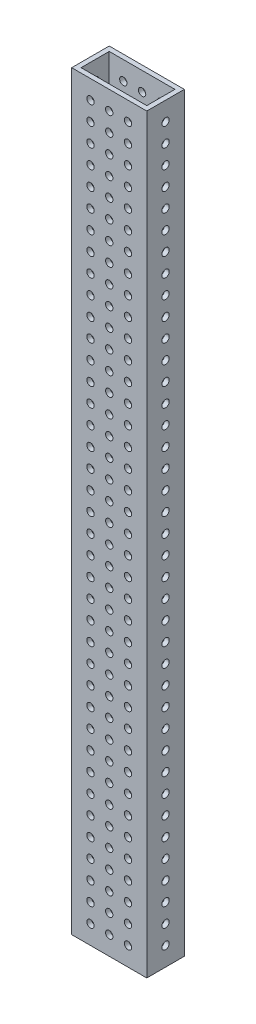
from build123d import *

# Parameters (mm, degrees)
SKETCH1_W            = 50.8
SKETCH1_H            = 25.4
SKETCH1_W_2          = 44.45
SKETCH1_H_2          = 19.05
BOSS_EXTRUDE1_DEPTH  = 254
SKETCH2_R            = 2.4892
CUT_EXTRUDE1_DEPTH   = 261.272549455
LPATTERN1_COUNT      = 39
LPATTERN1_PITCH      = 12.7
LPATTERN1_COUNT_DIR2 = 3
LPATTERN1_PITCH_DIR2 = 12.7
SKETCH3_R            = 2.4892
CUT_EXTRUDE2_DEPTH   = 261.272549455
LPATTERN2_COUNT      = 39
LPATTERN2_PITCH      = 12.7


with BuildPart() as part:
    # Sketch1 → Boss-Extrude1 (new, symmetric)
    with BuildSketch(Plane(origin=(0, 0, 0), x_dir=(1, 0, 0), z_dir=(0, 1, 0))):
        with Locations((25.4, 12.7)):
            Rectangle(SKETCH1_W, SKETCH1_H)
        with Locations((25.4, 12.7)):
            Rectangle(SKETCH1_W_2, SKETCH1_H_2, mode=Mode.SUBTRACT)
    extrude(amount=BOSS_EXTRUDE1_DEPTH, both=True)

    # Sketch2 → Cut-Extrude1 (cut, through all)
    with BuildSketch(Plane.XY):
        with Locations((12.7, 241.3)):
            Circle(SKETCH2_R)
    cut_extrude1 = extrude(amount=-CUT_EXTRUDE1_DEPTH, mode=Mode.SUBTRACT)

    # LPattern1: Cut-Extrude1 39 × 3
    with Locations(*[(j * LPATTERN1_PITCH_DIR2, -i * LPATTERN1_PITCH, 0) for i in range(LPATTERN1_COUNT) for j in range(LPATTERN1_COUNT_DIR2) if (i, j) != (0, 0)]):
        add(cut_extrude1, mode=Mode.SUBTRACT)

    # Sketch3 → Cut-Extrude2 (cut, through all)
    with BuildSketch(Plane(origin=(50.8, 0, 0), x_dir=(0, 0, -1), z_dir=(1, 0, 0))):
        with Locations((12.7, 241.3)):
            Circle(SKETCH3_R)
    cut_extrude2 = extrude(amount=-CUT_EXTRUDE2_DEPTH, mode=Mode.SUBTRACT)

    # LPattern2: Cut-Extrude2 ×39
    with Locations(*[(0, -i * LPATTERN2_PITCH, 0) for i in range(1, LPATTERN2_COUNT)]):
        add(cut_extrude2, mode=Mode.SUBTRACT)


solid = part.part
